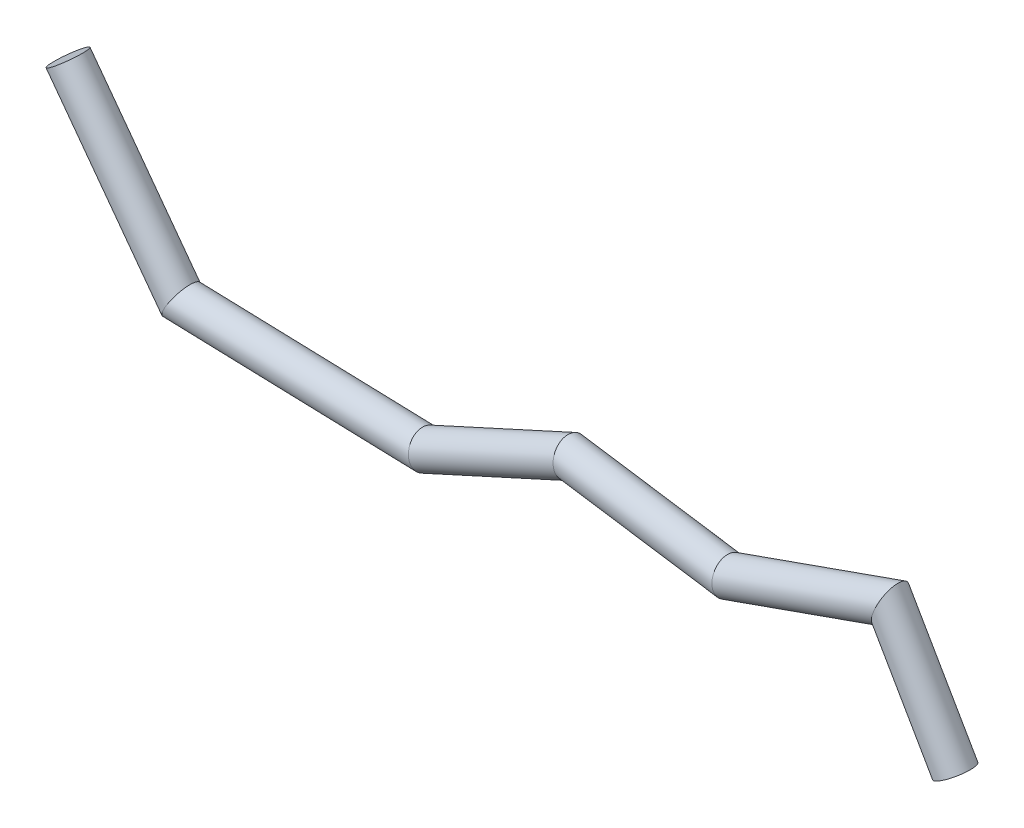
from build123d import *

# Parameters (mm, degrees)
SWEEP1_PROFILE_R = 6.35


with BuildPart() as part:
    # Sweep1: sweep along a path in Sketch2
    with BuildLine(Plane.XY) as sweep1_path:
        Line((-121.321774851, 25.344617349), (-79.496231466, -31.161414773))
        Line((-79.496231466, -31.161414773), (11.079614142, -33.931318309))
        Line((11.079614142, -33.931318309), (64.538752375, -9.556167197))
        Line((64.538752375, -9.556167197), (123.260707326, -18.419858511))
        Line((123.260707326, -18.419858511), (182.813633337, 2.631408359))
        Line((182.813633337, 2.631408359), (206.911794096, -39.194135026))
    # Sweep1 profile (on start of the path) → Sweep1 (sweep)
    with BuildSketch(Plane(origin=(-121.321774851, 25.344617349, 0), x_dir=(-0.8037665341662223, -0.5949448365642138, 0), z_dir=(0.5949448365642138, -0.8037665341662223, 0))):
        Circle(SWEEP1_PROFILE_R)
    sweep(path=sweep1_path.line, transition=Transition.RIGHT)


solid = part.part
